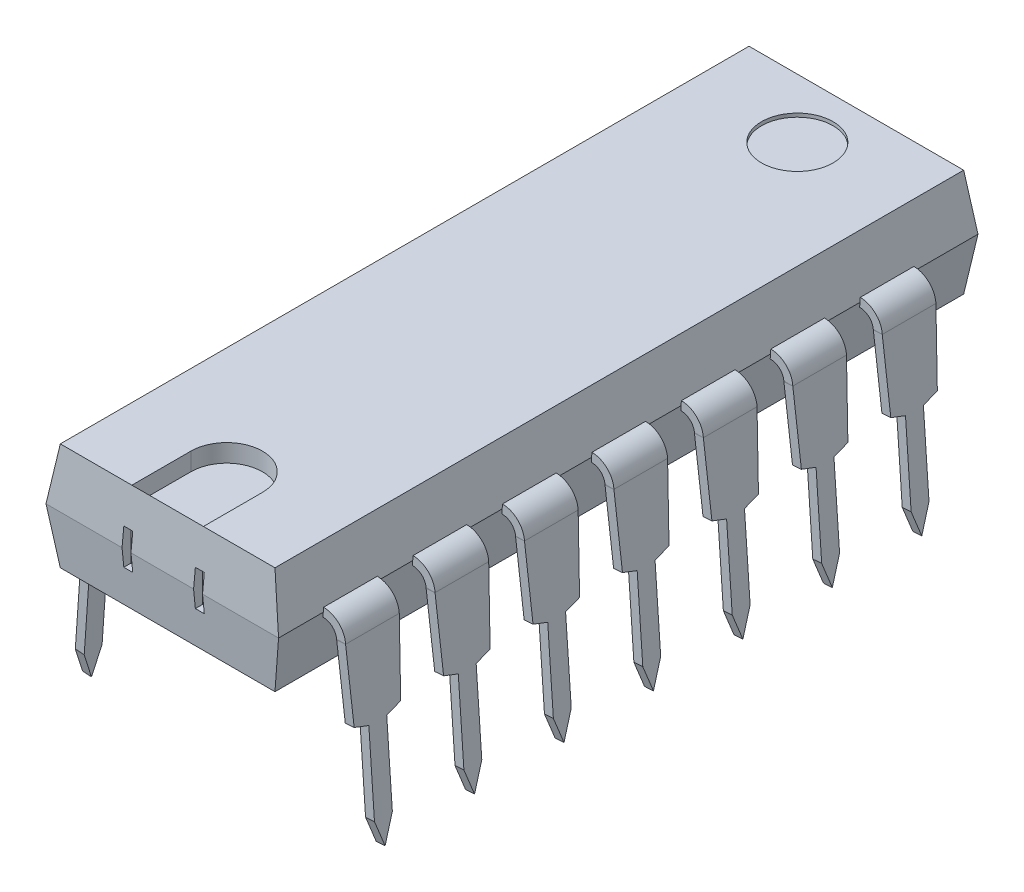
from build123d import *

# Parameters (mm, degrees)
SKETCH3_W          = 0.25
SKETCH3_H          = 1
CUT_EXTRUDE1_DEPTH = 0.25
SKETCH5_W          = 0.25
SKETCH5_H          = 1.5
CUT_EXTRUDE2_DEPTH = 0.249391013
LPATTERN1_COUNT    = 7
LPATTERN1_PITCH    = 2.5
CUT_EXTRUDE3_DEPTH = 0.5
SKETCH7_3_R        = 1
CUT_EXTRUDE4_DEPTH = 0.1


with BuildPart() as part:
    # Sketch1 → Loft1 section 0
    with BuildSketch(Plane(origin=(0, 0, 0), x_dir=(1, 0, 0), z_dir=(0, 1, 0))):
        with BuildLine():
            Line((-3, 9.625), (3, 9.625))
            Line((3, 9.625), (3, -9.625))
            Line((3, -9.625), (-3, -9.625))
            Line((-3, -9.625), (-3, 9.625))
        make_face()
    # Sketch2 → Loft1 section 1
    with BuildSketch(Plane(origin=(0, -1.5, 0), x_dir=(1, 0, 0), z_dir=(0, 1, 0))):
        with BuildLine():
            Line((3.25, -9.775), (-3.25, -9.775))
            Line((-3.25, -9.775), (-3.25, 9.775))
            Line((-3.25, 9.775), (3.25, 9.775))
            Line((3.25, 9.775), (3.25, -9.775))
        make_face()
    loft1 = loft()

    # Mirror1: Loft1 across plane
    add(loft1.mirror(Plane.ZX.offset(-1.5)))

    # Sketch3 → Cut-Extrude1 (cut)
    with BuildSketch(Plane.XY.offset(9.775)):
        with Locations((-1, -1.5)):
            Rectangle(SKETCH3_W, SKETCH3_H)
        with Locations((1, -1.5)):
            Rectangle(SKETCH3_W, SKETCH3_H)
    cut_extrude1 = extrude(amount=-CUT_EXTRUDE1_DEPTH, mode=Mode.SUBTRACT)

    # Mirror2: Cut-Extrude1 across plane
    add(cut_extrude1.mirror(Plane.XY), mode=Mode.SUBTRACT)

    # Sketch7 → Cut-Extrude3 (cut)
    with BuildSketch(Plane(origin=(0, 0, 0), x_dir=(1, 0, 0), z_dir=(0, 1, 0))):
        with BuildLine():
            ThreePointArc((1, -7.975), (0, -6.975), (-1, -7.975))
            Line((-1, -7.975), (-1, -9.625))
            Line((-1, -9.625), (1, -9.625))
            Line((1, -9.625), (1, -7.975))
        make_face()
    extrude(amount=-CUT_EXTRUDE3_DEPTH, mode=Mode.SUBTRACT)

    # Sketch7<3> → Cut-Extrude4 (cut)
    with BuildSketch(Plane(origin=(0, 0, 0), x_dir=(1, 0, 0), z_dir=(0, 1, 0))):
        with Locations(Location((0, 7.975, 0), (0, 0, 270))):
            Circle(SKETCH7_3_R)
    extrude(amount=-CUT_EXTRUDE4_DEPTH, mode=Mode.SUBTRACT)


with BuildPart() as body_2:
    # Sweep1: sweep along a path in Sketch4
    with BuildLine(Plane.XY.offset(7.775)) as sweep1_path:
        Line((4.104540041, -7.052698419), (3.748782025, -1.965121763))
        ThreePointArc((3.748782025, -1.965121763), (3.59099918, -1.634323149), (3.25, -1.5))
    # Sketch5 → Sweep1 (sweep)
    with BuildSketch(Plane(origin=(0, -7.052698419, 0), x_dir=(1, 0, 0), z_dir=(0, 1, 0))):
        with Locations((4.104540041, -7.775)):
            Rectangle(SKETCH5_W, SKETCH5_H)
    sweep(path=sweep1_path.line)

    # Sketch6 → Cut-Extrude2 (cut)
    with BuildSketch(Plane(origin=(3.71818629, 0.260000913, 0), x_dir=(0, 0, -1), z_dir=(0.9975640502598243, 0.06975647374412597, 0))):
        Polygon((-7.125, -4.230556199), (-7.525, -4.376144293), (-7.525, -6.630556199), (-7.775, -7.317425554), (-8.025, -6.630556199), (-8.025, -4.376144293), (-8.425, -4.230556199), (-8.525, -2.230556199), (-8.525, -3.830556199), (-8.525, -7.330556199), (-7.025, -7.330556199), (-7.025, -3.830556199), (-7.025, -2.230556199), align=None)
    extrude(amount=-CUT_EXTRUDE2_DEPTH, mode=Mode.SUBTRACT)


with BuildPart() as lpattern1_1:
    # LPattern1: pattern copy
    add(body_2.part.moved(Location(Vector(0, 0, -1) * (1 * LPATTERN1_PITCH))))


with BuildPart() as lpattern1_2:
    # LPattern1: pattern copy
    add(body_2.part.moved(Location(Vector(0, 0, -1) * (2 * LPATTERN1_PITCH))))


with BuildPart() as lpattern1_3:
    # LPattern1: pattern copy
    add(body_2.part.moved(Location(Vector(0, 0, -1) * (3 * LPATTERN1_PITCH))))


with BuildPart() as lpattern1_4:
    # LPattern1: pattern copy
    add(body_2.part.moved(Location(Vector(0, 0, -1) * (4 * LPATTERN1_PITCH))))


with BuildPart() as lpattern1_5:
    # LPattern1: pattern copy
    add(body_2.part.moved(Location(Vector(0, 0, -1) * (5 * LPATTERN1_PITCH))))


with BuildPart() as lpattern1_6:
    # LPattern1: pattern copy
    add(body_2.part.moved(Location(Vector(0, 0, -1) * (6 * LPATTERN1_PITCH))))


with BuildPart() as body_9:
    # Mirror3: mirrored copy
    add(body_2.part.mirror(Plane(origin=(0, 0, 0), x_dir=(0, 0, 1), z_dir=(1, 0, 0))))


with BuildPart() as body_10:
    # Mirror3 2: mirrored copy
    add(lpattern1_1.part.mirror(Plane(origin=(0, 0, 0), x_dir=(0, 0, 1), z_dir=(1, 0, 0))))


with BuildPart() as body_11:
    # Mirror3 3: mirrored copy
    add(lpattern1_2.part.mirror(Plane(origin=(0, 0, 0), x_dir=(0, 0, 1), z_dir=(1, 0, 0))))


with BuildPart() as body_12:
    # Mirror3 4: mirrored copy
    add(lpattern1_3.part.mirror(Plane(origin=(0, 0, 0), x_dir=(0, 0, 1), z_dir=(1, 0, 0))))


with BuildPart() as body_13:
    # Mirror3 5: mirrored copy
    add(lpattern1_4.part.mirror(Plane(origin=(0, 0, 0), x_dir=(0, 0, 1), z_dir=(1, 0, 0))))


with BuildPart() as body_14:
    # Mirror3 6: mirrored copy
    add(lpattern1_5.part.mirror(Plane(origin=(0, 0, 0), x_dir=(0, 0, 1), z_dir=(1, 0, 0))))


with BuildPart() as body_15:
    # Mirror3 7: mirrored copy
    add(lpattern1_6.part.mirror(Plane(origin=(0, 0, 0), x_dir=(0, 0, 1), z_dir=(1, 0, 0))))


solid = Compound([part.part, body_2.part, lpattern1_1.part, lpattern1_2.part, lpattern1_3.part, lpattern1_4.part, lpattern1_5.part, lpattern1_6.part, body_9.part, body_10.part, body_11.part, body_12.part, body_13.part, body_14.part, body_15.part])
